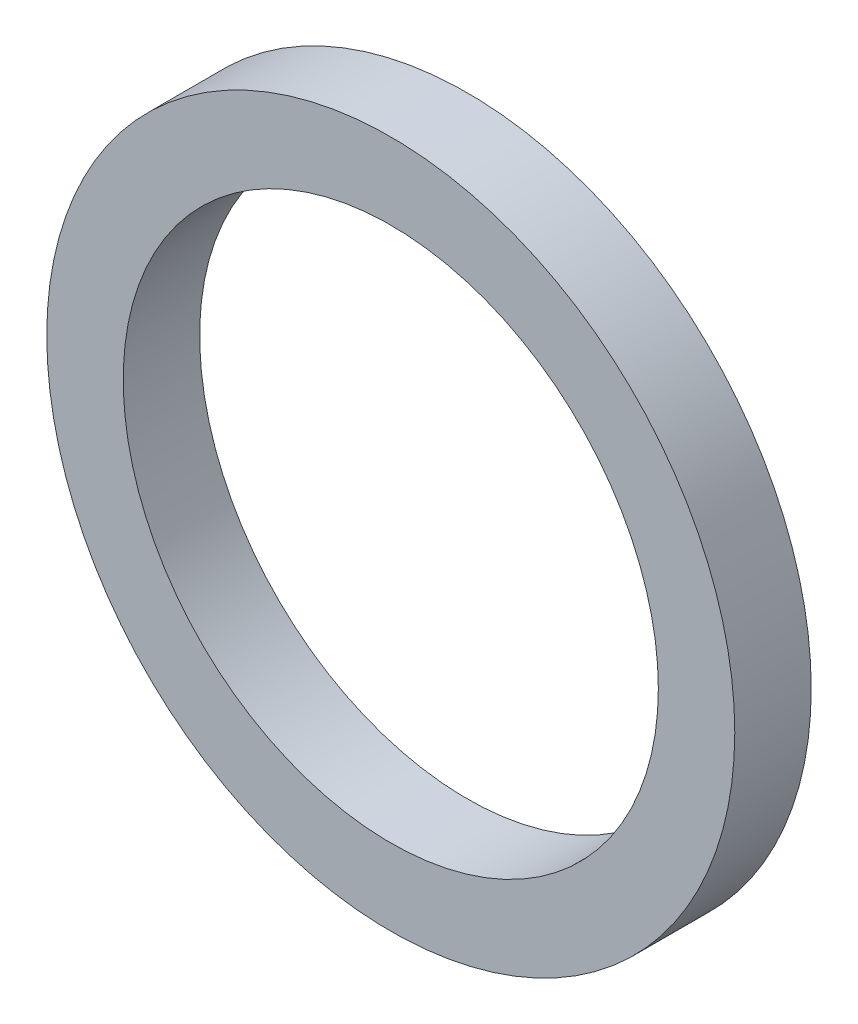
from build123d import *

# Parameters (mm, degrees)
SKETCH_1_R      = 45
SKETCH_1_R_2    = 35
EXTRUDE_1_DEPTH = 10


with BuildPart() as part:
    # 草图1 → 凸台-拉伸1 (new body)
    with BuildSketch(Plane.XY):
        Circle(SKETCH_1_R)
        Circle(SKETCH_1_R_2, mode=Mode.SUBTRACT)
    extrude(amount=EXTRUDE_1_DEPTH)


solid = part.part
